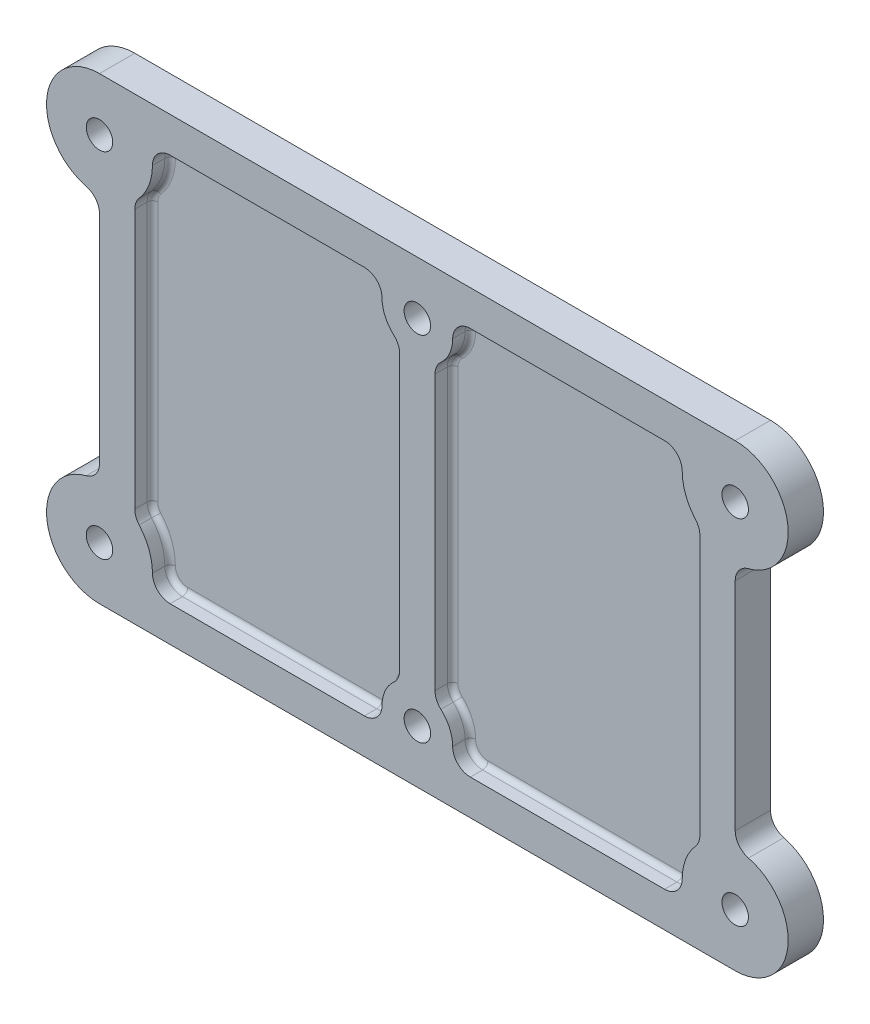
from build123d import *
from build123d.topology import SkipClean

# Parameters (mm, degrees)
SKETCH1_R           = 2.38125
BOSS_EXTRUDE1_DEPTH = 3.175
SKETCH2_R           = 2.38125
BOSS_EXTRUDE2_DEPTH = 3.175
FILLET1_R           = 0.9525


with BuildPart() as part:
    # Sketch1 → Boss-Extrude1 (new body)
    with BuildSketch(Plane.XY):
        with BuildLine():
            Line((57.15, 73.025), (-57.15, 73.025))
            ThreePointArc((-57.15, 73.025), (-66.599083, 64.700191), (-59.53125, 54.277458))
            ThreePointArc((-59.53125, 54.277458), (-57.814942, 53.14756), (-57.15, 51.203278))
            Line((-57.15, 51.203278), (-57.15, 12.296722))
            ThreePointArc((-57.15, 12.296722), (-57.814942, 10.35244), (-59.53125, 9.222542))
            ThreePointArc((-59.53125, 9.222542), (-66.599083, -1.200191), (-57.15, -9.525))
            Line((-57.15, -9.525), (57.15, -9.525))
            ThreePointArc((57.15, -9.525), (66.599083, -1.200191), (59.53125, 9.222542))
            ThreePointArc((59.53125, 9.222542), (57.814942, 10.35244), (57.15, 12.296722))
            Line((57.15, 12.296722), (57.15, 51.203278))
            ThreePointArc((57.15, 51.203278), (57.814942, 53.14756), (59.53125, 54.277458))
            ThreePointArc((59.53125, 54.277458), (66.599083, 64.700191), (57.15, 73.025))
        make_face()
        with BuildLine():
            ThreePointArc((-54.76875, 0), (-55.466202, -1.683798), (-57.15, -2.38125))
            ThreePointArc((-57.15, -2.38125), (-59.53125, 0), (-57.15, 2.38125))
            ThreePointArc((-57.15, 2.38125), (-55.466202, 1.683798), (-54.76875, 0))
        make_face(mode=Mode.SUBTRACT)
        Circle(SKETCH1_R, mode=Mode.SUBTRACT)
        with BuildLine():
            ThreePointArc((59.53125, 0), (58.833798, -1.683798), (57.15, -2.38125))
            ThreePointArc((57.15, -2.38125), (54.76875, 0), (57.15, 2.38125))
            ThreePointArc((57.15, 2.38125), (58.833798, 1.683798), (59.53125, 0))
        make_face(mode=Mode.SUBTRACT)
        with BuildLine():
            ThreePointArc((-54.76875, 63.5), (-55.466202, 61.816202), (-57.15, 61.11875))
            ThreePointArc((-57.15, 61.11875), (-59.53125, 63.5), (-57.15, 65.88125))
            ThreePointArc((-57.15, 65.88125), (-55.466202, 65.183798), (-54.76875, 63.5))
        make_face(mode=Mode.SUBTRACT)
        with Locations((0, 63.5)):
            Circle(SKETCH1_R, mode=Mode.SUBTRACT)
        with BuildLine():
            ThreePointArc((57.15, 61.11875), (54.76875, 63.5), (57.15, 65.88125))
            ThreePointArc((57.15, 65.88125), (58.833798, 65.183798), (59.53125, 63.5))
            ThreePointArc((59.53125, 63.5), (58.833798, 61.816202), (57.15, 61.11875))
        make_face(mode=Mode.SUBTRACT)
    extrude(amount=BOSS_EXTRUDE1_DEPTH)

    # Sketch2 → Boss-Extrude2 (add)
    with SkipClean():  # the faces are left unmerged after this step: merging them gives an invalid solid
        with BuildSketch(Plane.XY.offset(3.175)):
            with BuildLine():
                Line((-57.15, 73.025), (57.15, 73.025))
                ThreePointArc((57.15, 73.025), (66.599083, 64.700191), (59.53125, 54.277458))
                ThreePointArc((59.53125, 54.277458), (57.814942, 53.14756), (57.15, 51.203278))
                Line((57.15, 51.203278), (57.15, 12.296722))
                ThreePointArc((57.15, 12.296722), (57.814942, 10.35244), (59.53125, 9.222542))
                ThreePointArc((59.53125, 9.222542), (66.599083, -1.200191), (57.15, -9.525))
                Line((57.15, -9.525), (-57.15, -9.525))
                ThreePointArc((-57.15, -9.525), (-66.599083, -1.200191), (-59.53125, 9.222542))
                ThreePointArc((-59.53125, 9.222542), (-57.814942, 10.35244), (-57.15, 12.296722))
                Line((-57.15, 12.296722), (-57.15, 51.203278))
                ThreePointArc((-57.15, 51.203278), (-57.814942, 53.14756), (-59.53125, 54.277458))
                ThreePointArc((-59.53125, 54.277458), (-66.599083, 64.700191), (-57.15, 73.025))
            make_face()
            with Locations((-57.15, 63.5)):
                Circle(SKETCH2_R, mode=Mode.SUBTRACT)
            with Locations((57.15, 63.5)):
                Circle(SKETCH2_R, mode=Mode.SUBTRACT)
            with Locations((57.15, 0)):
                Circle(SKETCH2_R, mode=Mode.SUBTRACT)
            with Locations((-57.15, 0)):
                Circle(SKETCH2_R, mode=Mode.SUBTRACT)
            with Locations((0, 63.5)):
                Circle(SKETCH2_R, mode=Mode.SUBTRACT)
            Circle(SKETCH2_R, mode=Mode.SUBTRACT)
            with BuildLine():
                Line((9.525, -3.175), (44.45, -3.175))
                ThreePointArc((44.45, -3.175), (46.695064, -2.245064), (47.625, 0))
                ThreePointArc((47.625, 0), (48.240178, 3.367596), (50.00625, 6.300195))
                ThreePointArc((50.00625, 6.300195), (50.594941, 7.277728), (50.8, 8.40026))
                Line((50.8, 8.40026), (50.8, 55.09974))
                ThreePointArc((50.8, 55.09974), (50.594941, 56.222272), (50.00625, 57.199805))
                ThreePointArc((50.00625, 57.199805), (48.240178, 60.132404), (47.625, 63.5))
                ThreePointArc((47.625, 63.5), (46.695064, 65.745064), (44.45, 66.675))
                Line((44.45, 66.675), (9.525, 66.675))
                ThreePointArc((9.525, 66.675), (7.279936, 65.745064), (6.35, 63.5))
                ThreePointArc((6.35, 63.5), (5.79673, 60.907623), (4.233333, 58.766989))
                ThreePointArc((4.233333, 58.766989), (3.451635, 57.696672), (3.175, 56.400484))
                Line((3.175, 56.400484), (3.175, 7.099516))
                ThreePointArc((3.175, 7.099516), (3.451635, 5.803328), (4.233333, 4.733011))
                ThreePointArc((4.233333, 4.733011), (5.79673, 2.592377), (6.35, 0))
                ThreePointArc((6.35, 0), (7.279936, -2.245064), (9.525, -3.175))
            make_face(mode=Mode.SUBTRACT)
            with BuildLine():
                Line((-44.45, 66.675), (-9.525, 66.675))
                ThreePointArc((-9.525, 66.675), (-7.279936, 65.745064), (-6.35, 63.5))
                ThreePointArc((-6.35, 63.5), (-5.79673, 60.907623), (-4.233333, 58.766989))
                ThreePointArc((-4.233333, 58.766989), (-3.451635, 57.696672), (-3.175, 56.400484))
                Line((-3.175, 56.400484), (-3.175, 7.099516))
                ThreePointArc((-3.175, 7.099516), (-3.451635, 5.803328), (-4.233333, 4.733011))
                ThreePointArc((-4.233333, 4.733011), (-5.79673, 2.592377), (-6.35, 0))
                ThreePointArc((-6.35, 0), (-7.279936, -2.245064), (-9.525, -3.175))
                Line((-9.525, -3.175), (-44.45, -3.175))
                ThreePointArc((-44.45, -3.175), (-46.695064, -2.245064), (-47.625, 0))
                ThreePointArc((-47.625, 0), (-48.240178, 3.367596), (-50.00625, 6.300195))
                ThreePointArc((-50.00625, 6.300195), (-50.594941, 7.277728), (-50.8, 8.40026))
                Line((-50.8, 8.40026), (-50.8, 55.09974))
                ThreePointArc((-50.8, 55.09974), (-50.594941, 56.222272), (-50.00625, 57.199805))
                ThreePointArc((-50.00625, 57.199805), (-48.240178, 60.132404), (-47.625, 63.5))
                ThreePointArc((-47.625, 63.5), (-46.695064, 65.745064), (-44.45, 66.675))
            make_face(mode=Mode.SUBTRACT)
        extrude(amount=BOSS_EXTRUDE2_DEPTH)

    # Fillet1
    fillet1_edges = [part.edges().sort_by_distance(p)[0] for p in [
        (26.9875, 66.675, 3.175),
        (7.279936, 65.745064, 3.175),
        (5.79673, 60.907623, 3.175),
        (3.175, 31.75, 3.175),
        (3.451635, 5.803328, 3.175),
        (7.279936, -2.245064, 3.175),
        (26.9875, -3.175, 3.175),
        (-3.451635, 5.803328, 3.175),
        (-3.451635, 57.696672, 3.175),
        (-7.279936, 65.745064, 3.175),
        (-50.8, 31.75, 3.175),
        (-50.594941, 7.277728, 3.175),
        (-46.695064, -2.245064, 3.175),
        (-26.9875, -3.175, 3.175),
        (-3.175, 31.75, 3.175),
        (-5.79673, 60.907623, 3.175),
        (-26.9875, 66.675, 3.175),
        (-46.695064, 65.745064, 3.175),
        (-48.240178, 60.132404, 3.175),
        (-50.594941, 56.222272, 3.175),
        (-48.240178, 3.367596, 3.175),
        (-7.279936, -2.245064, 3.175),
        (-5.79673, 2.592377, 3.175),
        (3.451635, 57.696672, 3.175),
        (5.79673, 2.592377, 3.175),
        (46.695064, -2.245064, 3.175),
        (48.240178, 3.367596, 3.175),
        (50.594941, 7.277728, 3.175),
        (50.8, 31.75, 3.175),
        (50.594941, 56.222272, 3.175),
        (48.240178, 60.132404, 3.175),
        (46.695064, 65.745064, 3.175),
    ]]
    fillet(fillet1_edges, radius=FILLET1_R)


solid = part.part
